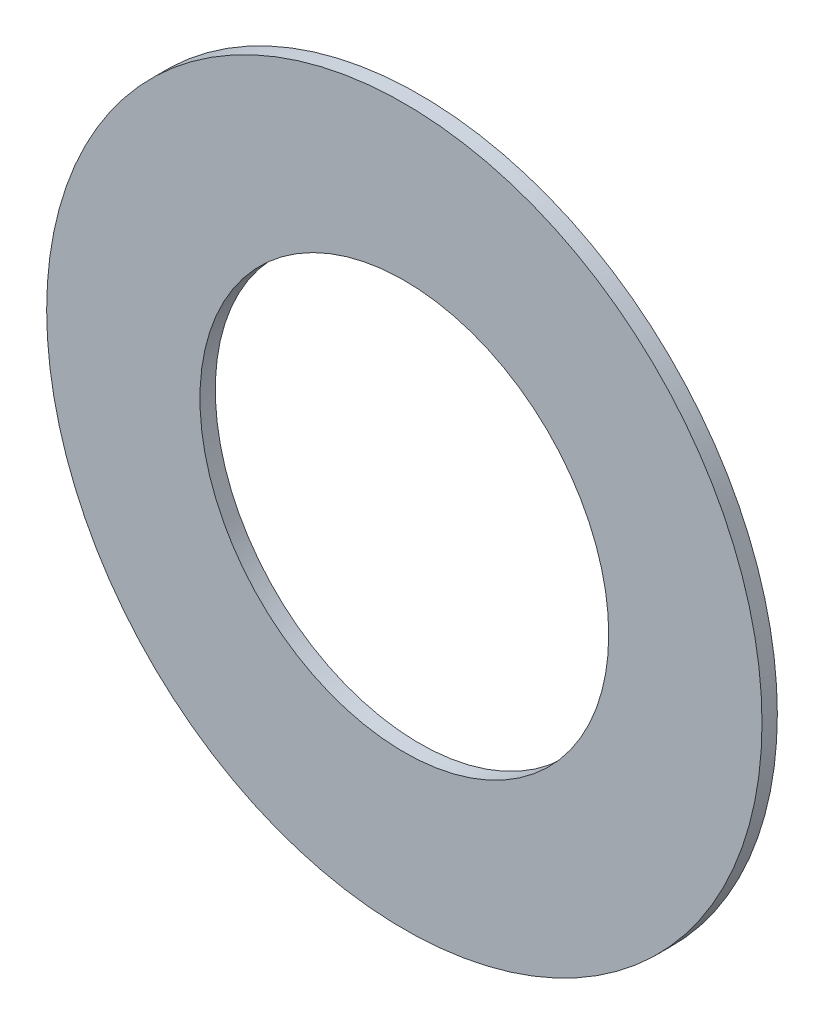
from build123d import *

# Parameters (mm, degrees)
SKETCH1_R           = 7
SKETCH1_R_2         = 4
BOSS_EXTRUDE1_DEPTH = 0.3


with BuildPart() as part:
    # Sketch1 → Boss-Extrude1 (new body)
    with BuildSketch(Plane.XY):
        Circle(SKETCH1_R)
        Circle(SKETCH1_R_2, mode=Mode.SUBTRACT)
    extrude(amount=BOSS_EXTRUDE1_DEPTH)


solid = part.part
